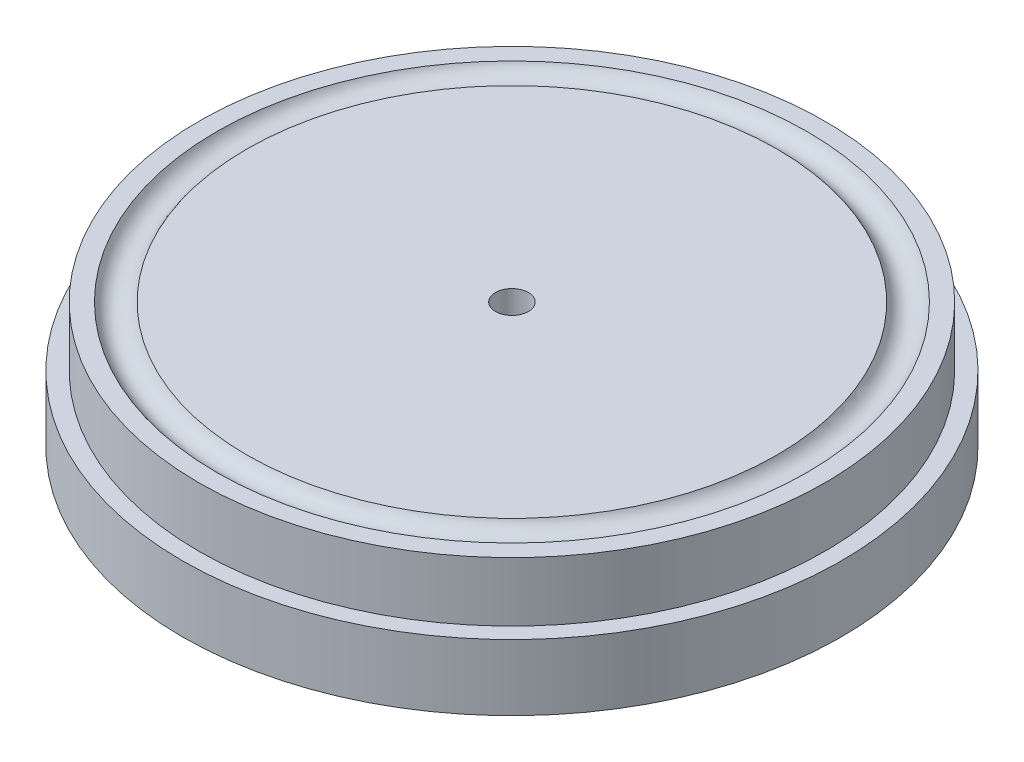
from build123d import *

# Parameters (mm, degrees)
SKETCH1_R           = 50
BOSS_EXTRUDE1_DEPTH = 10
SKETCH3_R           = 47.5
BOSS_EXTRUDE2_DEPTH = 10
SKETCH5_R           = 2.5
SKETCH6_R           = 2.5
CUT_EXTRUDE1_DEPTH  = 5
CUT_EXTRUDE2_START  = -1
SKETCH7_R           = 47.5
CUT_EXTRUDE2_DEPTH  = 1


with BuildPart() as part:
    # Sketch1 → Boss-Extrude1 (new body)
    with BuildSketch(Plane(origin=(0, 0, 0), x_dir=(1, 0, 0), z_dir=(0, 1, 0))):
        with Locations(Location((0, 0, 0), (0, 0, 270))):
            Circle(SKETCH1_R)
    extrude(amount=BOSS_EXTRUDE1_DEPTH)

    # Sketch3 → Boss-Extrude2 (add)
    with BuildSketch(Plane(origin=(0, 10, 0), x_dir=(1, 0, 0), z_dir=(0, 1, 0))):
        with Locations(Location((0, 0, 0), (0, 0, 270))):
            Circle(SKETCH3_R)
    extrude(amount=BOSS_EXTRUDE2_DEPTH)

    # Cut-Sweep1: sweep along a path in Sketch4
    with BuildLine(Plane(origin=(0, 20, 0), x_dir=(1, 0, 0), z_dir=(0, 1, 0))) as cut_sweep1_path:
        CenterArc((0, 0), 42.5, 0, 360)
    # Sketch5 → Cut-Sweep1 (sweep, cut)
    with BuildSketch(Plane.XY):
        with Locations((42.5, 20)):
            Circle(SKETCH5_R)
    sweep(path=cut_sweep1_path.line, mode=Mode.SUBTRACT)

    # Sketch6 → Cut-Extrude1 (cut)
    with BuildSketch(Plane(origin=(0, 20, 0), x_dir=(1, 0, 0), z_dir=(0, 1, 0))):
        with Locations(Location((0, 0, 0), (0, 0, 270))):
            Circle(SKETCH6_R)
    extrude(amount=-CUT_EXTRUDE1_DEPTH, mode=Mode.SUBTRACT)

    # Sketch7 → Cut-Extrude2 (cut)
    with BuildSketch(Plane(origin=(0, 20, 0), x_dir=(1, 0, 0), z_dir=(0, 1, 0)).offset(CUT_EXTRUDE2_START)):
        with Locations(Location((0, 0, 0), (0, 0, 270))):
            Circle(SKETCH7_R)
    extrude(amount=CUT_EXTRUDE2_DEPTH, mode=Mode.SUBTRACT)


solid = part.part
